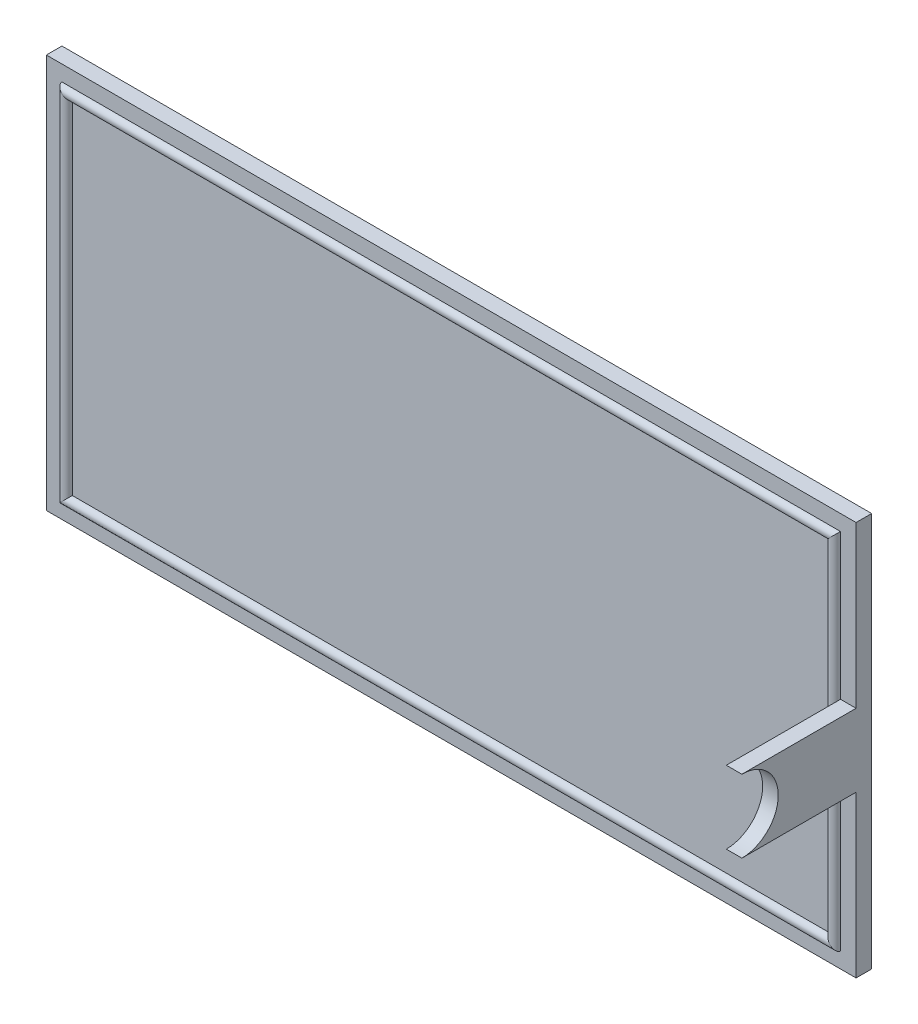
from build123d import *

# Parameters (mm, degrees)
ESQUISSE1_W             = 78
ESQUISSE1_H             = 38
BOSS_EXTRU_1_DEPTH      = 1.5
BALAYAGE1_PROFILE_R     = 0.5
ESQUISSE14_W            = 1.5
ESQUISSE14_H            = 7
BOSS_EXTRU_2_DEPTH      = 11
ENL_V_MAT_EXTRU_1_DEPTH = 11


with BuildPart() as part:
    # Esquisse1 → Boss.-Extru.1 (new body)
    with BuildSketch(Plane.XY):
        with Locations((39, 19)):
            Rectangle(ESQUISSE1_W, ESQUISSE1_H)
    extrude(amount=BOSS_EXTRU_1_DEPTH)

    # Balayage1: sweep along a curve in space
    with BuildLine() as balayage1_path:
        Line((2, 2, 1.5), (76, 2, 1.5))
        Line((76, 2, 1.5), (76, 36, 1.5))
        Line((76, 36, 1.5), (2, 36, 1.5))
        Line((2, 36, 1.5), (2, 2, 1.5))
    # Balayage1 profile (on start of the path) → Balayage1 (sweep)
    with BuildSketch(Plane(origin=(2, 2, 1.5), x_dir=(0, 0, 1), z_dir=(1, 0, 0))):
        Circle(BALAYAGE1_PROFILE_R)
    sweep(path=balayage1_path.line, transition=Transition.RIGHT)

    # Esquisse14 → Boss.-Extru.2 (add)
    with BuildSketch(Plane.XY.offset(1.5)):
        with Locations((77.25, 19)):
            Rectangle(ESQUISSE14_W, ESQUISSE14_H)
    extrude(amount=BOSS_EXTRU_2_DEPTH)

    # Esquisse15 → Enlèv. mat.-Extru.1 (cut)
    with BuildSketch(Plane(origin=(78, 0, 0), x_dir=(0, 0, -1), z_dir=(1, 0, 0))):
        with BuildLine():
            Line((-12.5, 15.5), (-14.376884621, 15.5))
            ThreePointArc((-14.376884621, 15.5), (-17.876884621, 19), (-14.376884621, 22.5))
            Line((-14.376884621, 22.5), (-12.5, 22.5))
            ThreePointArc((-12.5, 22.5), (-9, 19), (-12.5, 15.5))
        make_face()
    extrude(amount=-ENL_V_MAT_EXTRU_1_DEPTH, mode=Mode.SUBTRACT)


solid = part.part
